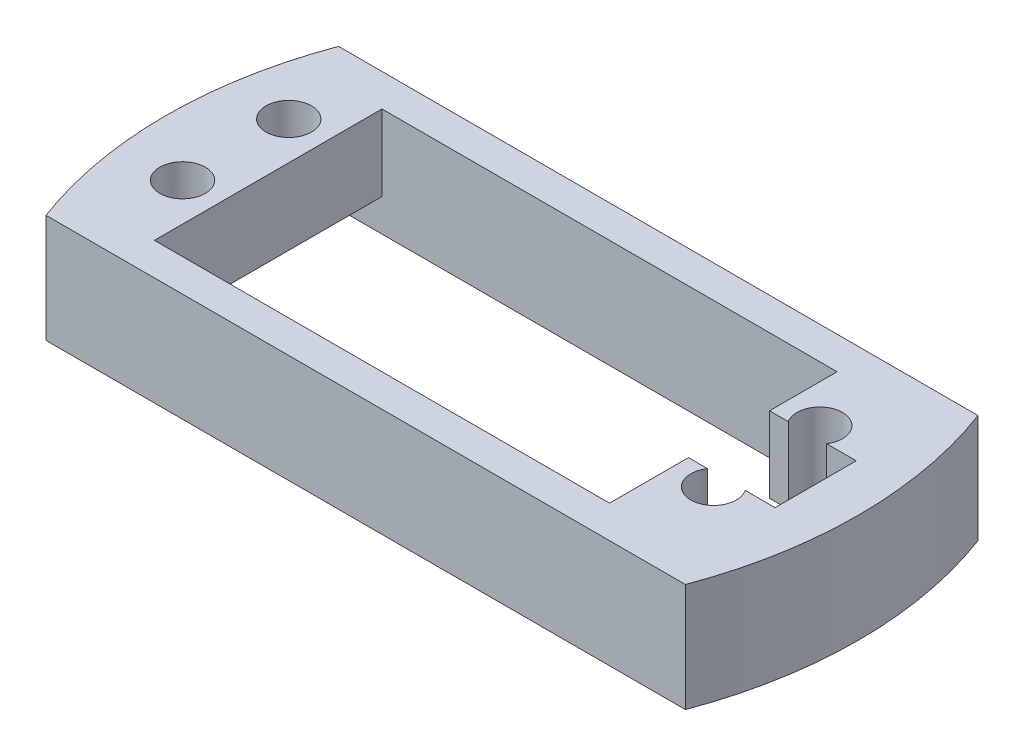
from build123d import *

# Parameters (mm, degrees)
SKETCH1_R           = 2.1
SKETCH1_W           = 42
SKETCH1_H           = 21
BOSS_EXTRUDE1_DEPTH = 10
SKETCH2_W           = 8
SKETCH2_H           = 7.485714894
CUT_EXTRUDE1_DEPTH  = 10
SKETCH3_W           = 7.57739789
SKETCH3_H           = 21
SKETCH3_W_2         = 7.925755829
SKETCH3_H_2         = 20.976807548
CUT_EXTRUDE3_DEPTH  = 3


with BuildPart() as part:
    # Sketch1 → Boss-Extrude1 (new body)
    with BuildSketch(Plane(origin=(0, 0, 0), x_dir=(1, 0, 0), z_dir=(0, 1, 0))):
        with BuildLine():
            Line((-37, 14.15897814), (22, 14.15897814))
            ThreePointArc((22, 14.15897814), (24.444487245, 0.65897814), (22, -12.84102186))
            Line((22, -12.84102186), (-37, -12.84102186))
            ThreePointArc((-37, -12.84102186), (-39.444487245, 0.65897814), (-37, 14.15897814))
        make_face()
        with Locations(Location((15.5, 6.05897814, 0), (0, 0, 270))):
            Circle(SKETCH1_R, mode=Mode.SUBTRACT)
        with Locations(Location((15.5, -3.74102186, 0), (0, 0, 270))):
            Circle(SKETCH1_R, mode=Mode.SUBTRACT)
        with Locations(Location((-33.5, 6.05897814, 0), (0, 0, 90))):
            Circle(SKETCH1_R, mode=Mode.SUBTRACT)
        with Locations(Location((-33.5, -3.74102186, 0), (0, 0, 90))):
            Circle(SKETCH1_R, mode=Mode.SUBTRACT)
        with Locations((-9, 0.65897814)):
            Rectangle(SKETCH1_W, SKETCH1_H, mode=Mode.SUBTRACT)
    extrude(amount=BOSS_EXTRUDE1_DEPTH)

    # Sketch2 → Cut-Extrude1 (cut)
    with BuildSketch(Plane(origin=(0, 0, 0), x_dir=(1, 0, 0), z_dir=(0, 1, 0))):
        with Locations((16, 1.180915362)):
            Rectangle(SKETCH2_W, SKETCH2_H)
    extrude(amount=CUT_EXTRUDE1_DEPTH, mode=Mode.SUBTRACT)

    # Sketch3 → Cut-Extrude3 (cut)
    with BuildSketch(Plane(origin=(0, 0, 0), x_dir=(1, 0, 0), z_dir=(0, 1, 0))):
        with Locations((-33.788698945, 0.65897814)):
            Rectangle(SKETCH3_W, SKETCH3_H)
        with Locations((15.962877914, 0.670574366)):
            Rectangle(SKETCH3_W_2, SKETCH3_H_2)
    extrude(amount=CUT_EXTRUDE3_DEPTH, mode=Mode.SUBTRACT)


solid = part.part
